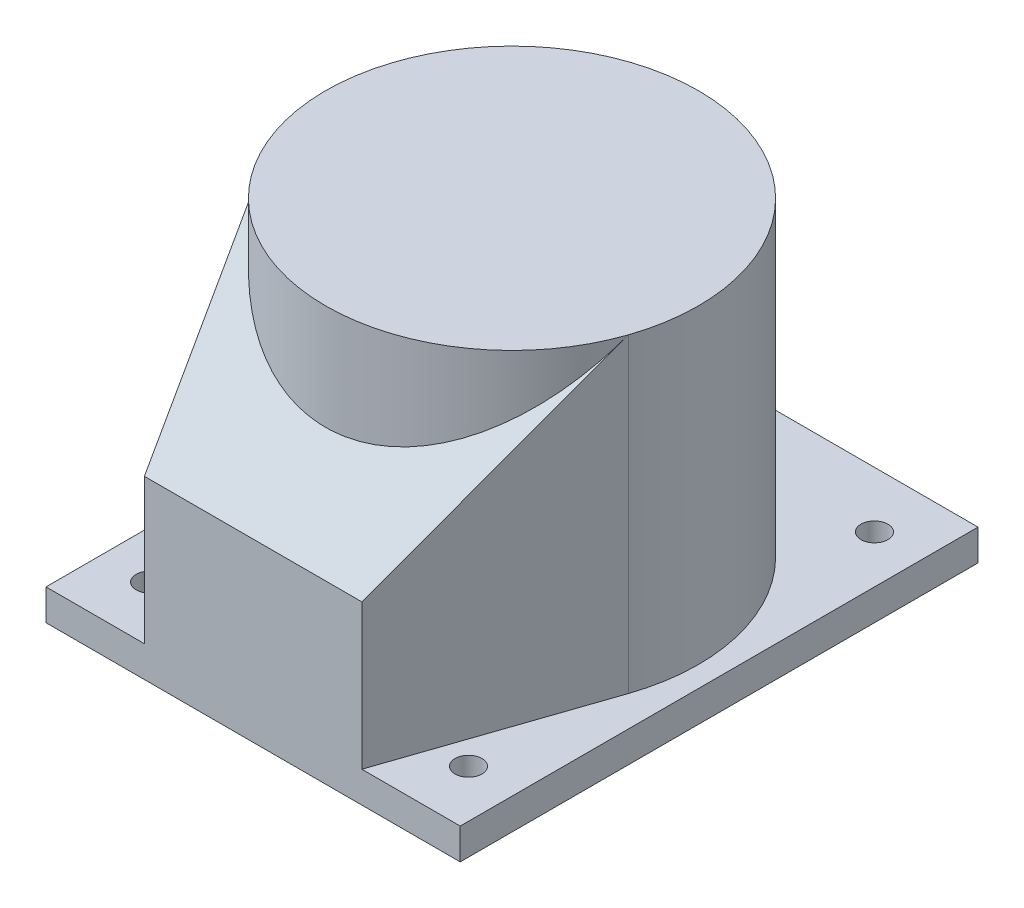
from build123d import *

# Parameters (mm, degrees)
SKETCH1_W               = 250
SKETCH1_H               = 200
SKETCH1_R               = 6.5
BOSS_EXTRUDE1_DEPTH     = 15
BOSS_EXTRUDE2_DEPTH     = 150
CUT_EXTRUDE1_DEPTH      = 230.891278651
CUT_EXTRUDE1_DEPTH_BACK = 230.891278651
BOSS_EXTRUDE3_REACH     = 231.891
BODY_MOVE_COPY1_ANGLE   = 90


with BuildPart() as part:
    # Sketch1 → Boss-Extrude1 (new body)
    with BuildSketch(Plane(origin=(0, 0, 0), x_dir=(1, 0, 0), z_dir=(0, 1, 0))):
        Rectangle(SKETCH1_W, SKETCH1_H)
        with Locations(Location((-98, 77, 0), (0, 0, 270))):
            Circle(SKETCH1_R, mode=Mode.SUBTRACT)
        with Locations(Location((98, 77, 0), (0, 0, 90))):
            Circle(SKETCH1_R, mode=Mode.SUBTRACT)
        with Locations(Location((-98, -77, 0), (0, 0, 90))):
            Circle(SKETCH1_R, mode=Mode.SUBTRACT)
        with Locations(Location((98, -77, 0), (0, 0, 270))):
            Circle(SKETCH1_R, mode=Mode.SUBTRACT)
    extrude(amount=BOSS_EXTRUDE1_DEPTH)

    # Sketch2 → Boss-Extrude2 (add)
    with BuildSketch(Plane(origin=(0, 15, 0), x_dir=(1, 0, 0), z_dir=(0, 1, 0))):
        with BuildLine():
            Line((125, 52.5), (29.018785036, 85.193368962))
            ThreePointArc((29.018785036, 85.193368962), (-90, 0), (29.018785036, -85.193368962))
            Line((29.018785036, -85.193368962), (125, -52.5))
            Line((125, -52.5), (125, 52.5))
        make_face()
    extrude(amount=BOSS_EXTRUDE2_DEPTH)

    # Sketch3 → Cut-Extrude1 (cut, two sides: drawn at the far end of the back side and taken through both)
    with BuildSketch(Plane.XY.offset(-CUT_EXTRUDE1_DEPTH_BACK)):
        Polygon((-384.335484925, 509.529308254), (29.018785036, 165), (125, 85), (538.354269961, -259.529308254), (1227.412886469, 567.179231668), (304.723131583, 1336.237848176), align=None)
    extrude(amount=CUT_EXTRUDE1_DEPTH + CUT_EXTRUDE1_DEPTH_BACK, mode=Mode.SUBTRACT)

    # Sketch4 → Boss-Extrude3 (add, up to next)
    with BuildSketch(Plane(origin=(0, 165, 0), x_dir=(1, 0, 0), z_dir=(0, 1, 0)), mode=Mode.PRIVATE) as boss_extrude3_sk1:
        with BuildLine():
            Line((29.018785036, -85.193368962), (29.018785036, 85.193368962))
            ThreePointArc((29.018785036, 85.193368962), (90, 0), (29.018785036, -85.193368962))
        make_face()
    boss_extrude3_tool1 = extrude(boss_extrude3_sk1.sketch, amount=-BOSS_EXTRUDE3_REACH, mode=Mode.PRIVATE) - part.part
    add(boss_extrude3_tool1.solids().sort_by_distance((54.295969, 165, 0))[0])


with BuildPart() as part_1:
    # Body-Move/Copy1: moved
    add(part.part.rotate(Axis((0, 0, 0), (0, -1, 0)), BODY_MOVE_COPY1_ANGLE))


solid = part_1.part
